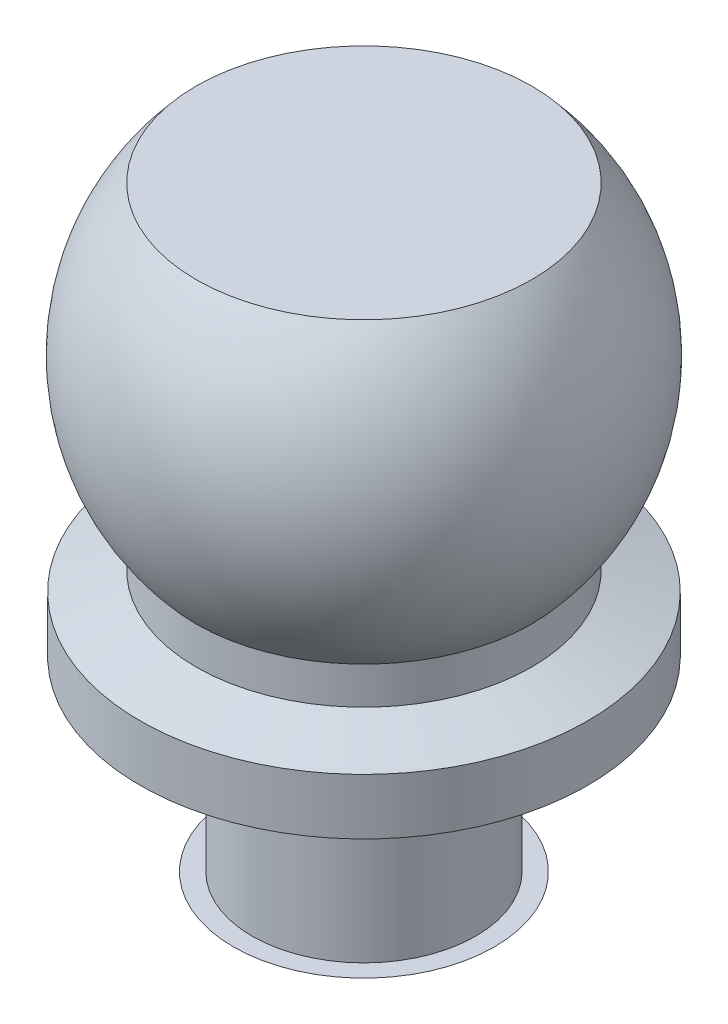
from build123d import *


with BuildPart() as part:
    # Esquisse1 → Révolution1 (revolve)
    with BuildSketch(Plane.XY):
        with BuildLine():
            Line((-4.5, 66.319551268), (0, 66.319551268))
            Line((0, 66.319551268), (0, 49.319551268))
            ThreePointArc((0, 49.319551268), (-1.820027472, 49.574455115), (-3.5, 50.319551268))
            Line((-3.5, 50.319551268), (-3, 50.319551268))
            Line((-3, 50.319551268), (-3, 55.319551268))
            Line((-3, 55.319551268), (-6, 55.319551268))
            Line((-6, 55.319551268), (-6, 56.819551268))
            Line((-6, 56.819551268), (-4.5, 57.319551268))
            Line((-4.5, 57.319551268), (-4.5, 58.319551268))
            ThreePointArc((-4.5, 58.319551268), (-6.027864045, 62.319551268), (-4.5, 66.319551268))
        make_face()
    revolve(axis=Axis((0, 0, 0), (0, 1, 0)))


solid = part.part
